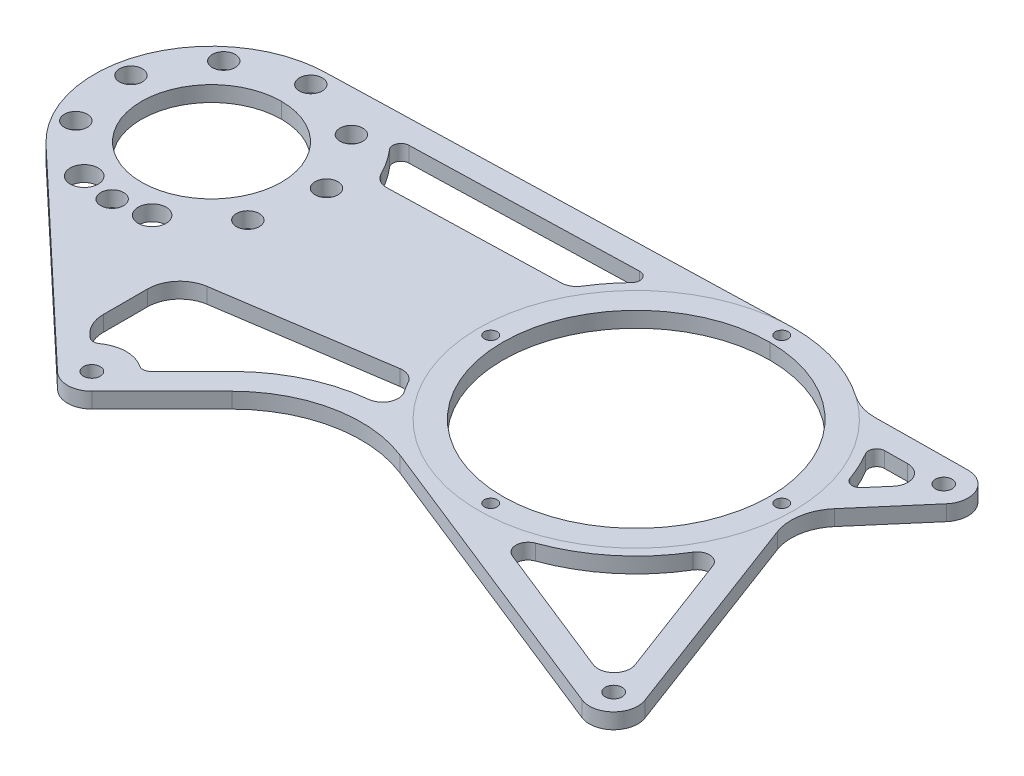
from build123d import *

# Parameters (mm, degrees)
MASTER_SKETCH_R       = 52.451
MASTER_SKETCH_R_2     = 9.525
MASTER_SKETCH_R_3     = 45.974
MASTER_SKETCH_R_4     = 27.4955
MASTER_SKETCH_R_5     = 5.5
BOSS_EXTRUDE2_DEPTH   = 6.096
F_5_0MM_DOWEL_HOLE1_D = 5
CIRPATTERN4_COUNT     = 4
M6_CLEARANCE_HOLE4_D  = 6.6
M8_CLEARANCE_HOLE1_D  = 9
CIRPATTERN3_COUNT     = 18
CUT_EXTRUDE1_DEPTH    = 284.854467488


with BuildPart() as part:
    # Master Sketch → Boss-Extrude2 (new body)
    # profile 1 of 5: a face of its own
    with BuildSketch(Plane(origin=(0, 0, 0), x_dir=(1, 0, 0), z_dir=(0, 1, 0))):
        with BuildLine():
            ThreePointArc((-8.636, 127), (-36.396097826, 84.787887478), (-86.152093601, 93.552952189))
            Line((-86.152093601, 93.552952189), (-6.534964144, 18.470363023))
            ThreePointArc((-6.534964144, 18.470363023), (-3.773598517, 34.145603423), (9.525, 25.4))
            ThreePointArc((9.525, 25.4), (8.799952547, 21.754940307), (6.735192091, 18.664807909))
            Line((6.735192091, 18.664807909), (34.255961574, 46.185577392))
            ThreePointArc((34.255961574, 46.185577392), (59.945142207, 60.02346539), (89.010077776, 57.44457682))
            Line((89.010077776, 57.44457682), (207.987004211, 9.951947906))
            ThreePointArc((207.987004211, 9.951947906), (204.851852042, 25.601533276), (220.43444462, 22.148779315))
            Line((220.43444462, 22.148779315), (189.133864847, 105.44289655))
            ThreePointArc((189.133864847, 105.44289655), (188.207777178, 115.4635324), (192.51641215, 124.557840832))
            Line((192.51641215, 124.557840832), (212.800120602, 148.168522003))
            ThreePointArc((212.800120602, 148.168522003), (196.940842995, 150.353698677), (205.472725722, 163.899866417))
            Line((205.472725722, 163.899866417), (169.599038165, 163.514054819))
            ThreePointArc((169.599038165, 163.514054819), (163.800537316, 164.352688386), (158.531122559, 166.913779261))
            ThreePointArc((158.531122559, 166.913779261), (141.706259737, 175.147152322), (123.19, 177.9778))
            Line((123.19, 177.9778), (-54.61, 172.974))
            ThreePointArc((-54.61, 172.974), (-22.101472842, 159.508527158), (-8.636, 127))
        make_face()
        with Locations(Location((123.19, 116.0018, 0), (0, 0, 90))):
            Circle(MASTER_SKETCH_R, mode=Mode.SUBTRACT)
    # profile 2 of 5: a face of its own
    with BuildSketch(Plane(origin=(0, 0, 0), x_dir=(1, 0, 0), z_dir=(0, 1, 0))):
        with Locations((0, 25.4)):
            Circle(MASTER_SKETCH_R_2)
    # profile 3 of 5: a face of its own
    with BuildSketch(Plane(origin=(0, 0, 0), x_dir=(1, 0, 0), z_dir=(0, 1, 0))):
        with Locations((211.518208908, 18.79820239)):
            Circle(MASTER_SKETCH_R_2)
    # profile 4 of 5: a face of its own
    with BuildSketch(Plane(origin=(0, 0, 0), x_dir=(1, 0, 0), z_dir=(0, 1, 0))):
        with Locations((205.575158542, 154.375417219)):
            Circle(MASTER_SKETCH_R_2)
    # profile 5 of 5: a face of its own
    with BuildSketch(Plane(origin=(0, 0, 0), x_dir=(1, 0, 0), z_dir=(0, 1, 0))):
        with Locations((-54.61, 127)):
            Circle(MASTER_SKETCH_R_3)
        with Locations(Location((-54.61, 127, 0), (0, 0, 90))):
            Circle(MASTER_SKETCH_R_4, mode=Mode.SUBTRACT)
        with Locations(Location((-41.27121441, 90.351987789, 0), (0, 0, 90))):
            Circle(MASTER_SKETCH_R_5, mode=Mode.SUBTRACT)
        with Locations(Location((-67.94878559, 90.351987789, 0), (0, 0, 90))):
            Circle(MASTER_SKETCH_R_5, mode=Mode.SUBTRACT)
    extrude(amount=BOSS_EXTRUDE2_DEPTH)

    # Ø5.0mm Dowel Hole1 (through all)
    with Locations(Plane(origin=(0, 6.096, 0), x_dir=(1, 0, 0), z_dir=(0, 1, 0))):
        with Locations((123.19, 173.14676824)):
            f_5_0mm_dowel_hole1 = Hole(F_5_0MM_DOWEL_HOLE1_D / 2)

    # CirPattern4: Ø5.0mm Dowel Hole1 ×4 about axis
    cirpattern4_axis = Axis((123.19, 0, -116.0018), (0, 1, 0))
    for i in range(1, CIRPATTERN4_COUNT):
        add(f_5_0mm_dowel_hole1.rotate(cirpattern4_axis, i * 360 / CIRPATTERN4_COUNT), mode=Mode.SUBTRACT)

    # M6 Clearance Hole4 (through all)
    with Locations(Plane(origin=(0, 6.096, 0), x_dir=(1, 0, 0), z_dir=(0, 1, 0))):
        with Locations((205.575158542, 154.375417219), (211.518208908, 18.79820239), (0, 25.4)):
            Hole(M6_CLEARANCE_HOLE4_D / 2)

    # M8 Clearance Hole1 (through all)
    with Locations(Plane(origin=(0, 6.096, 0), x_dir=(1, 0, 0), z_dir=(0, 1, 0))):
        with Locations((-54.61, 166)):
            m8_clearance_hole1 = Hole(M8_CLEARANCE_HOLE1_D / 2)

    # CirPattern3: M8 Clearance Hole1 ×18 about axis, 10 skipped
    cirpattern3_axis = Axis((-54.61, 6.096, -127), (0, -1, 0))
    add([m8_clearance_hole1.rotate(cirpattern3_axis, i * 360 / CIRPATTERN3_COUNT) for i in range(1, CIRPATTERN3_COUNT) if i not in (1, 3, 5, 7, 8, 10, 11, 13, 15, 17)], mode=Mode.SUBTRACT)

    # Topology 1 → Cut-Extrude1 (cut, through all)
    with BuildSketch(Plane(origin=(0, 6.096, 0), x_dir=(1, 0, 0), z_dir=(0, 1, 0))):
        with BuildLine():
            ThreePointArc((67.281456447, 150.672141126), (71.26845327, 156.399210575), (75.839660388, 161.67173688))
            ThreePointArc((75.839660388, 161.67173688), (76.458883843, 165.158331399), (73.46509413, 167.049627827))
            Line((73.46509413, 167.049627827), (-14.700169403, 164.56840541))
            ThreePointArc((-14.700169403, 164.56840541), (-17.514771269, 162.678357132), (-17.018226233, 159.324596677))
            ThreePointArc((-17.018226233, 159.324596677), (-13.365554188, 154.512119056), (-10.325367902, 149.291082638))
            ThreePointArc((-10.325367902, 149.291082638), (-7.908159584, 146.693689239), (-4.474760882, 145.79863512))
            Line((-4.474760882, 145.79863512), (62.063515299, 147.671212322))
            ThreePointArc((62.063515299, 147.671212322), (65.050656221, 148.51412343), (67.281456447, 150.672141126))
        make_face()
        with BuildLine():
            ThreePointArc((68.334394598, 79.68843673), (68.764556906, 73.722595945), (63.886881332, 70.260721182))
            ThreePointArc((63.886881332, 70.260721182), (44.213471784, 64.716380715), (27.520769483, 52.920769483))
            Line((27.520769483, 52.920769483), (11.599172261, 36.999172261))
            ThreePointArc((11.599172261, 36.999172261), (9.657159805, 36.083732416), (7.576574711, 36.613457017))
            ThreePointArc((7.576574711, 36.613457017), (-0.198277171, 38.93169571), (-7.901868408, 36.386654554))
            ThreePointArc((-7.901868408, 36.386654554), (-9.966039712, 35.796197685), (-11.934040176, 36.65434491))
            Line((-11.934040176, 36.65434491), (-13.130428791, 37.782594013))
            ThreePointArc((-13.130428791, 37.782594013), (-16.07794783, 41.990645294), (-17.117143266, 47.022109982))
            Line((-17.117143266, 47.022109982), (-17.117143266, 64.392614711))
            ThreePointArc((-17.117143266, 64.392614711), (-14.042484998, 72.677709553), (-6.307254046, 76.95117678))
            Line((-6.307254046, 76.95117678), (59.587432499, 86.868574701))
            ThreePointArc((59.587432499, 86.868574701), (63.174454879, 86.315869277), (65.811602789, 83.822344916))
            ThreePointArc((65.811602789, 83.822344916), (67.034945598, 81.732168237), (68.334394598, 79.68843673))
        make_face()
        with BuildLine():
            ThreePointArc((206.458947193, 32.26142708), (204.959027962, 25.492155206), (198.160653587, 24.130206141))
            Line((198.160653587, 24.130206141), (145.349760257, 45.211000835))
            ThreePointArc((145.349760257, 45.211000835), (142.353542672, 49.714608993), (145.500239117, 54.114393959))
            ThreePointArc((145.500239117, 54.114393959), (164.91203471, 65.138555749), (179.519499105, 82.019667539))
            ThreePointArc((179.519499105, 82.019667539), (184.033435332, 84.302068881), (188.055524715, 81.234859539))
            Line((188.055524715, 81.234859539), (206.458947193, 32.26142708))
        make_face()
        with BuildLine():
            Line((190.604833072, 136.949630286), (196.435820245, 143.737027147))
            ThreePointArc((196.435820245, 143.737027147), (197.375389236, 150.556102986), (191.550890325, 154.22459009))
            Line((191.550890325, 154.22459009), (182.60327011, 154.128360907))
            ThreePointArc((182.60327011, 154.128360907), (179.873089832, 152.515317466), (179.900424771, 149.344348167))
            ThreePointArc((179.900424771, 149.344348167), (182.824339377, 143.778469401), (185.203579034, 137.958890231))
            ThreePointArc((185.203579034, 137.958890231), (187.613336253, 135.897613045), (190.604833072, 136.949630286))
        make_face()
    extrude(amount=-CUT_EXTRUDE1_DEPTH, mode=Mode.SUBTRACT)


solid = part.part
